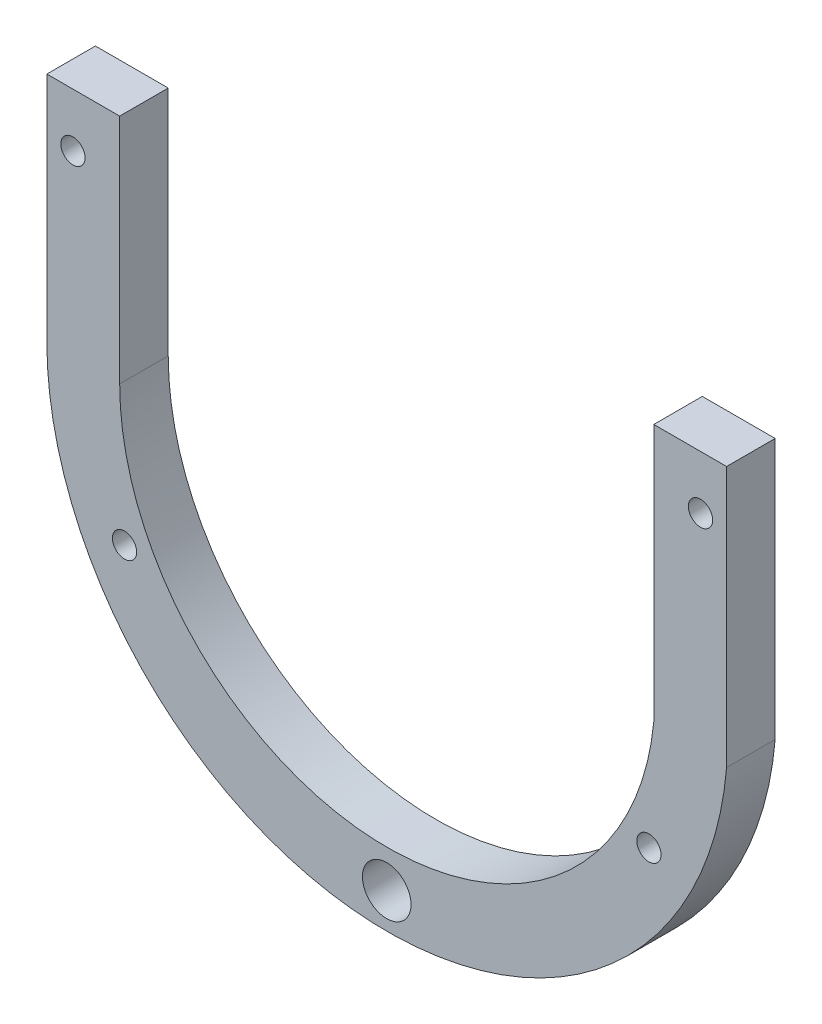
from build123d import *

# Parameters (mm, degrees)
SKETCH_1_W          = 200
SKETCH_1_H          = 100
EXTRUDE_1_DEPTH     = 8
SKETCH_2_OUTSIDE_W  = 246.75
SKETCH_2_OUTSIDE_H  = 146.75
CUT_EXTRUDE_1_DEPTH = 223.081848133
SKETCH_3_R          = 2
SKETCH_3_R_2        = 4
CUT_EXTRUDE_2_DEPTH = 184.742611471


with BuildPart() as part:
    # 草图1 → 凸台-拉伸1 (new body)
    with BuildSketch(Plane.XY):
        with Locations((100, 46.209912536)):
            Rectangle(SKETCH_1_W, SKETCH_1_H)
    extrude(amount=EXTRUDE_1_DEPTH)

    # 草图2 outside → 切除-拉伸1 (cut, through all)
    with BuildSketch(Plane.XY.offset(8)):
        with Locations((100, 46.21)):
            Rectangle(SKETCH_2_OUTSIDE_W, SKETCH_2_OUTSIDE_H)
        with BuildLine():
            Line((156, 96.209912536), (156, 53.259476571))
            ThreePointArc((156, 53.259476571), (97.731456144, 1.942362699), (44, 57.992340397))
            Line((44, 57.992340397), (44, 96.209912536))
            Line((44, 96.209912536), (56, 96.209912536))
            Line((56, 96.209912536), (56, 57.992340397))
            ThreePointArc((56, 57.992340397), (98, 13.942368774), (144, 53.797105004))
            Line((144, 53.797105004), (144, 96.209912536))
            Line((144, 96.209912536), (156, 96.209912536))
        make_face(mode=Mode.SUBTRACT)
    extrude(amount=-CUT_EXTRUDE_1_DEPTH, mode=Mode.SUBTRACT)

    # 草图3 → 切除-拉伸2 (cut, through all)
    with BuildSketch(Plane.XY.offset(13)):
        with Locations((48.3, 87.392340397)):
            Circle(SKETCH_3_R)
        with Locations((56.8, 35.392340397)):
            Circle(SKETCH_3_R)
        with Locations((143.2, 35.392340397)):
            Circle(SKETCH_3_R)
        with Locations((151.7, 87.392340397)):
            Circle(SKETCH_3_R)
        with Locations((100, 7.692340397)):
            Circle(SKETCH_3_R_2)
    extrude(amount=-CUT_EXTRUDE_2_DEPTH, mode=Mode.SUBTRACT)


solid = part.part
